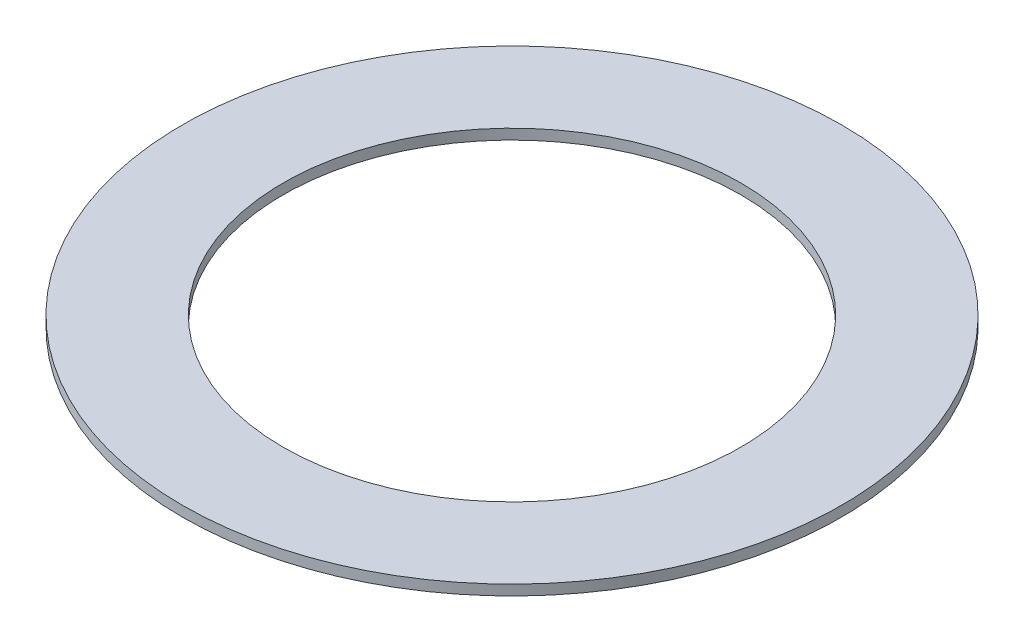
from build123d import *

# Parameters (mm, degrees)
SKETCH1_R           = 8
SKETCH1_R_2         = 5.55625
BOSS_EXTRUDE1_DEPTH = 0.25


with BuildPart() as part:
    # Sketch1 → Boss-Extrude1 (new body)
    with BuildSketch(Plane(origin=(0, 0, 0), x_dir=(1, 0, 0), z_dir=(0, 1, 0))):
        with Locations(Location((0, 0, 0), (0, 0, 270))):
            Circle(SKETCH1_R)
        with Locations(Location((0, 0, 0), (0, 0, 270))):
            Circle(SKETCH1_R_2, mode=Mode.SUBTRACT)
    extrude(amount=BOSS_EXTRUDE1_DEPTH)


solid = part.part
